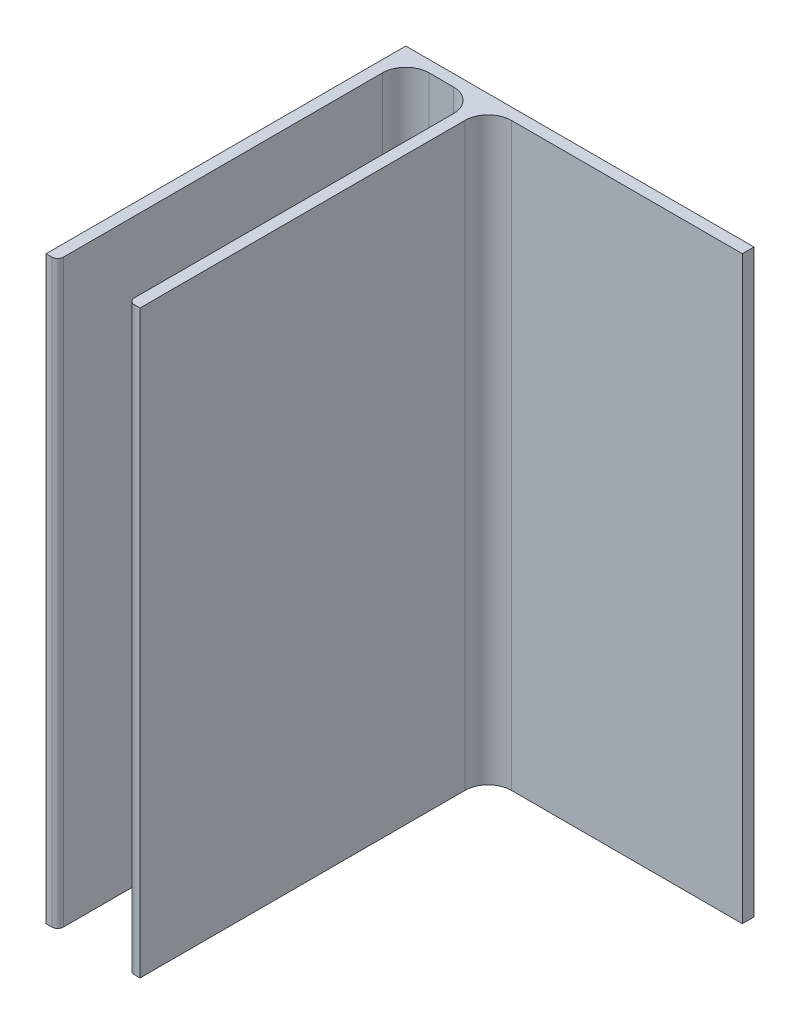
from build123d import *

# Parameters (mm, degrees)
SKETCH1_W           = 30
SKETCH1_H           = 50
BOSS_EXTRUDE1_DEPTH = 1
SKETCH2_W           = 1
SKETCH2_H           = 50
BOSS_EXTRUDE2_DEPTH = 30
FILLET2_R           = 2
FILLET3_R           = 0.5


with BuildPart() as part:
    # Sketch1 → Boss-Extrude1 (new body)
    with BuildSketch(Plane.XY):
        with Locations((15, 25)):
            Rectangle(SKETCH1_W, SKETCH1_H)
    extrude(amount=BOSS_EXTRUDE1_DEPTH)

    # Sketch2 → Boss-Extrude2 (add)
    with BuildSketch(Plane.XY.offset(1)):
        with Locations((0.5, 25)):
            Rectangle(SKETCH2_W, SKETCH2_H)
        with Locations((7.6, 25)):
            Rectangle(SKETCH2_W, SKETCH2_H)
    extrude(amount=BOSS_EXTRUDE2_DEPTH)

    # Fillet2
    fillet2_edges = [part.edges().sort_by_distance(p)[0] for p in [
        (1, 25, 1),
        (7.1, 25, 1),
        (8.1, 25, 1),
    ]]
    fillet(fillet2_edges, radius=FILLET2_R)

    # Fillet3
    fillet3_edges = [part.edges().sort_by_distance(p)[0] for p in [
        (1, 25, 31),
        (7.1, 25, 31),
    ]]
    fillet(fillet3_edges, radius=FILLET3_R)


solid = part.part
